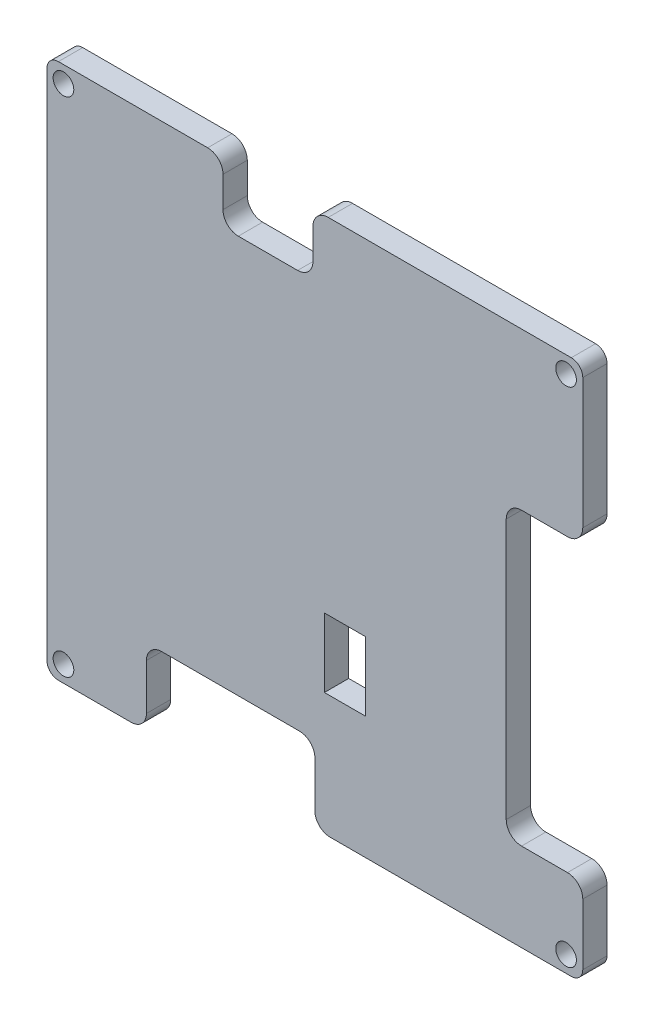
from build123d import *

# Parameters (mm, degrees)
SKETCH1_W               = 70
SKETCH1_H               = 70
SKETCH1_R               = 1.35
BOSS_EXTRUDE1_DEPTH     = 3.175
FILLET1_R               = 1.5
CUT_EXTRUDE1_DEPTH      = 50.599199842
CUT_EXTRUDE1_DEPTH_BACK = 50.599199842
SKETCH2_W               = 10
SKETCH2_H               = 38
FILLET2_R               = 2
CUT_EXTRUDE2_DEPTH      = 50.599199842
CUT_EXTRUDE2_DEPTH_BACK = 50.599199842
SKETCH3_W               = 22
SKETCH3_H               = 10
SKETCH3_W_2             = 11.75
SKETCH3_H_2             = 8
SKETCH3_W_3             = 5.35
SKETCH3_H_3             = 9
FILLET3_R               = 2


with BuildPart() as part:
    # Sketch1 → Boss-Extrude1 (new body)
    with BuildSketch(Plane.XY):
        Rectangle(SKETCH1_W, SKETCH1_H)
        with Locations((-32.84, 32.82)):
            Circle(SKETCH1_R, mode=Mode.SUBTRACT)
        with Locations((-32.84, -32.84)):
            Circle(SKETCH1_R, mode=Mode.SUBTRACT)
        with Locations((32.82, -32.84)):
            Circle(SKETCH1_R, mode=Mode.SUBTRACT)
        with Locations((32.82, 32.82)):
            Circle(SKETCH1_R, mode=Mode.SUBTRACT)
    extrude(amount=BOSS_EXTRUDE1_DEPTH)

    # Fillet1
    fillet1_edges = [part.edges().sort_by_distance(p)[0] for p in [
        (35, -35, 1.5875),
        (-35, -35, 1.5875),
        (-35, 35, 1.5875),
        (35, 35, 1.5875),
    ]]
    fillet(fillet1_edges, radius=FILLET1_R)

    # Sketch2 → Cut-Extrude1 (cut, two sides: drawn at the far end of the back side and taken through both)
    with BuildSketch(Plane(origin=(0, 0, 0), x_dir=(-1, 0, 0), z_dir=(0, 0, -1)).offset(-CUT_EXTRUDE1_DEPTH_BACK)):
        with Locations((-30, -4.5)):
            Rectangle(SKETCH2_W, SKETCH2_H)
    extrude(amount=CUT_EXTRUDE1_DEPTH + CUT_EXTRUDE1_DEPTH_BACK, mode=Mode.SUBTRACT)

    # Fillet2
    fillet2_edges = [part.edges().sort_by_distance(p)[0] for p in [
        (35, -23.5, 1.5875),
        (25, 14.5, 1.5875),
        (35, 14.5, 1.5875),
        (25, -23.5, 1.5875),
    ]]
    fillet(fillet2_edges, radius=FILLET2_R)

    # Sketch3 → Cut-Extrude2 (cut, two sides: drawn at the far end of the back side and taken through both)
    with BuildSketch(Plane(origin=(0, 0, 0), x_dir=(-1, 0, 0), z_dir=(0, 0, -1)).offset(-CUT_EXTRUDE2_DEPTH_BACK)):
        with Locations((11, -30)):
            Rectangle(SKETCH3_W, SKETCH3_H)
        with Locations((6.125, 31)):
            Rectangle(SKETCH3_W_2, SKETCH3_H_2)
        with Locations((-3.925, -14.5)):
            Rectangle(SKETCH3_W_3, SKETCH3_H_3)
    extrude(amount=CUT_EXTRUDE2_DEPTH + CUT_EXTRUDE2_DEPTH_BACK, mode=Mode.SUBTRACT)

    # Fillet3
    fillet3_edges = [part.edges().sort_by_distance(p)[0] for p in [
        (-22, -35, 1.5875),
        (0, -25, 1.5875),
        (-22, -25, 1.5875),
        (0, -35, 1.5875),
        (-12, 27, 1.5875),
        (-0.25, 35, 1.5875),
        (-12, 35, 1.5875),
        (-0.25, 27, 1.5875),
    ]]
    fillet(fillet3_edges, radius=FILLET3_R)


solid = part.part
